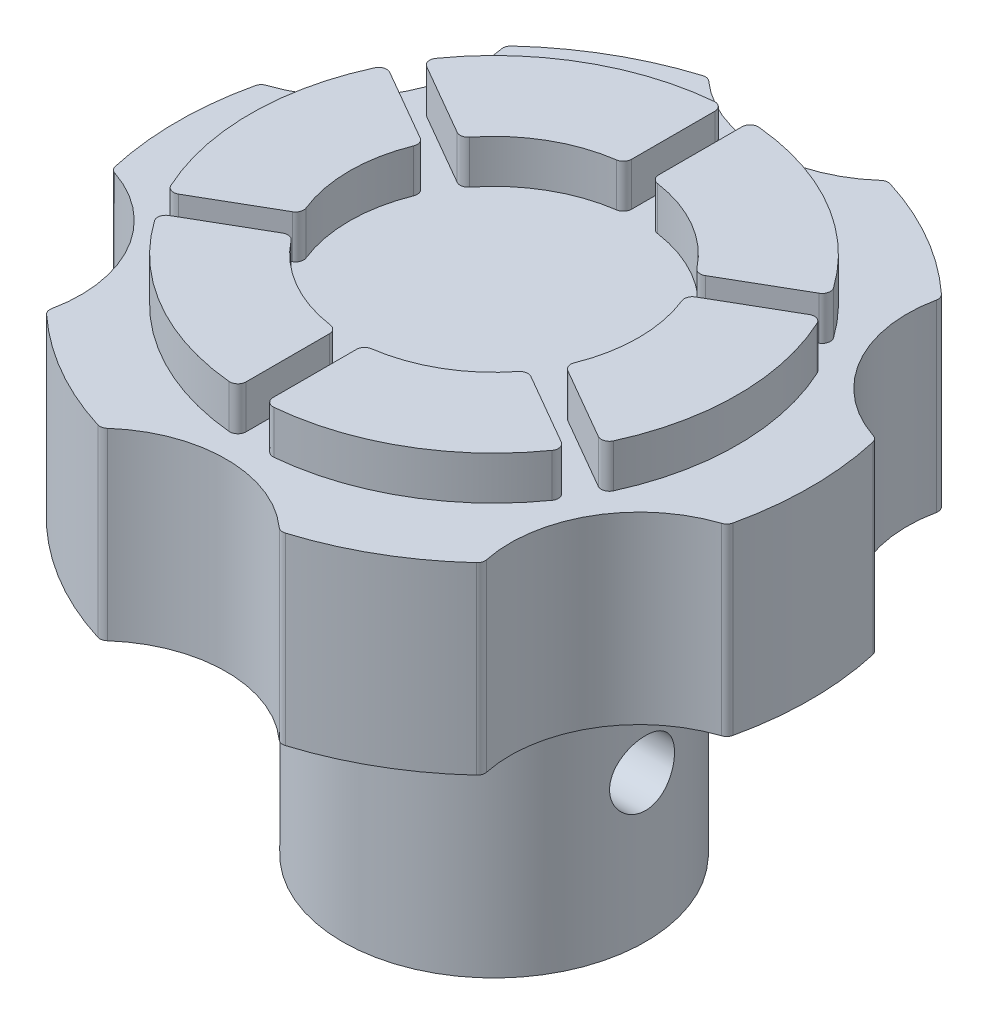
from build123d import *

# Parameters (mm, degrees)
SALIENTE_EXTRUIR1_DEPTH    = 17
CROQUIS2_R                 = 22.5
CROQUIS2_R_2               = 13.35
SALIENTE_EXTRUIR2_DEPTH    = 4
CORTAR_EXTRUIR1_DEPTH      = 4
CROQUIS4_R                 = 14
SALIENTE_EXTRUIR3_DEPTH    = 2
CROQUIS5_R                 = 14
CROQUIS5_R_2               = 7.9375
SALIENTE_EXTRUIR4_DEPTH    = 25
CORTAR_EXTRUIR2_DEPTH      = 49.703824285
CORTAR_EXTRUIR2_DEPTH_BACK = 49.703824285
CROQUIS6_R                 = 3
REDONDEO1_R                = 1
CHAFL_N1_SIZE              = 1
REDONDEO2_R                = 0.75


with BuildPart() as part:
    # Croquis1 → Saliente-Extruir1 (new body)
    with BuildSketch(Plane(origin=(0, 0, 0), x_dir=(1, 0, 0), z_dir=(0, 1, 0))):
        with BuildLine():
            ThreePointArc((8.25, -28.062430401), (14.625, -25.331243061), (20.177777619, -21.175924782))
            ThreePointArc((20.177777619, -21.175924782), (21.434128744, -12.375), (28.427777619, -6.886505619))
            ThreePointArc((28.427777619, -6.886505619), (29.25, 0), (28.427777619, 6.886505619))
            ThreePointArc((28.427777619, 6.886505619), (21.434128744, 12.375), (20.177777619, 21.175924782))
            ThreePointArc((20.177777619, 21.175924782), (14.625, 25.331243061), (8.25, 28.062430401))
            ThreePointArc((8.25, 28.062430401), (0, 24.75), (-8.25, 28.062430401))
            ThreePointArc((-8.25, 28.062430401), (-14.625, 25.331243061), (-20.177777619, 21.175924782))
            ThreePointArc((-20.177777619, 21.175924782), (-21.434128744, 12.375), (-28.427777619, 6.886505619))
            ThreePointArc((-28.427777619, 6.886505619), (-29.25, 0), (-28.427777619, -6.886505619))
            ThreePointArc((-28.427777619, -6.886505619), (-21.434128744, -12.375), (-20.177777619, -21.175924782))
            ThreePointArc((-20.177777619, -21.175924782), (-14.625, -25.331243061), (-8.25, -28.062430401))
            ThreePointArc((-8.25, -28.062430401), (0, -24.75), (8.25, -28.062430401))
        make_face()
    extrude(amount=SALIENTE_EXTRUIR1_DEPTH)

    # Croquis2 → Saliente-Extruir2 (add)
    with BuildSketch(Plane(origin=(0, 17, 0), x_dir=(1, 0, 0), z_dir=(0, 1, 0))):
        with Locations(Location((0, 0, 0), (0, 0, 270))):
            Circle(CROQUIS2_R)
        with Locations(Location((0, 0, 0), (0, 0, 270))):
            Circle(CROQUIS2_R_2, mode=Mode.SUBTRACT)
    extrude(amount=SALIENTE_EXTRUIR2_DEPTH)

    # Croquis3 → Cortar-Extruir1 (cut)
    with BuildSketch(Plane(origin=(0, 17, 0), x_dir=(1, 0, 0), z_dir=(0, 1, 0))):
        with BuildLine():
            Line((-1.25, -22.465250945), (-1.25, -2.165063509))
            Line((-1.25, -2.165063509), (-18.83047802, -12.315157227))
            ThreePointArc((-18.83047802, -12.315157227), (-19.485571585, -11.25), (-20.08047802, -10.150093718))
            Line((-20.08047802, -10.150093718), (-2.5, 0))
            Line((-2.5, 0), (-20.08047802, 10.150093718))
            ThreePointArc((-20.08047802, 10.150093718), (-19.485571585, 11.25), (-18.83047802, 12.315157227))
            Line((-18.83047802, 12.315157227), (-1.25, 2.165063509))
            Line((-1.25, 2.165063509), (-1.25, 22.465250945))
            ThreePointArc((-1.25, 22.465250945), (0, 22.5), (1.25, 22.465250945))
            Line((1.25, 22.465250945), (1.25, 2.165063509))
            Line((1.25, 2.165063509), (18.83047802, 12.315157227))
            ThreePointArc((18.83047802, 12.315157227), (19.485571585, 11.25), (20.08047802, 10.150093718))
            Line((20.08047802, 10.150093718), (2.5, 0))
            Line((2.5, 0), (20.08047802, -10.150093718))
            ThreePointArc((20.08047802, -10.150093718), (19.485571585, -11.25), (18.83047802, -12.315157227))
            Line((18.83047802, -12.315157227), (1.25, -2.165063509))
            Line((1.25, -2.165063509), (1.25, -22.465250945))
            ThreePointArc((1.25, -22.465250945), (0, -22.5), (-1.25, -22.465250945))
        make_face()
    extrude(amount=CORTAR_EXTRUIR1_DEPTH, mode=Mode.SUBTRACT)

    # Croquis4 → Saliente-Extruir3 (add)
    with BuildSketch(Plane.XZ):
        with Locations(Location((0, 0, 0), (0, 0, 270))):
            Circle(CROQUIS4_R)
    extrude(amount=SALIENTE_EXTRUIR3_DEPTH)

    # Croquis5 → Saliente-Extruir4 (add)
    with BuildSketch(Plane.XZ.offset(2)):
        with Locations(Location((0, 0, 0), (0, 0, 270))):
            Circle(CROQUIS5_R)
        with Locations(Location((0, 0, 0), (0, 0, 270))):
            Circle(CROQUIS5_R_2, mode=Mode.SUBTRACT)
    extrude(amount=SALIENTE_EXTRUIR4_DEPTH)

    # Croquis6 → Cortar-Extruir2 (cut, two sides: drawn at the far end of the back side and taken through both)
    with BuildSketch(Plane(origin=(0, 0, 0), x_dir=(0, 0, -1), z_dir=(1, 0, 0)).offset(-CORTAR_EXTRUIR2_DEPTH_BACK)):
        with Locations((0, -13.5)):
            Circle(CROQUIS6_R)
    extrude(amount=CORTAR_EXTRUIR2_DEPTH + CORTAR_EXTRUIR2_DEPTH_BACK, mode=Mode.SUBTRACT)

    # Redondeo1
    redondeo1_edges = [part.edges().sort_by_distance(p)[0] for p in [
        (0, 0, 14),
    ]]
    fillet(redondeo1_edges, radius=REDONDEO1_R)

    # Chaflán1
    chafl_n1_edges = [part.edges().sort_by_distance(p)[0] for p in [
        (0, -27, 7.9375),
    ]]
    chamfer(chafl_n1_edges, length=CHAFL_N1_SIZE)

    # Redondeo2
    redondeo2_edges = [part.edges().sort_by_distance(p)[0] for p in [
        (-1.25, 19, -22.465250945),
        (-10.885647245, 19, -7.72820704),
        (-18.83047802, 19, -12.315157227),
        (-12.135647245, 19, -5.563143531),
        (-20.08047802, 19, -10.150093718),
        (-12.135647245, 19, 5.563143531),
        (-20.08047802, 19, 10.150093718),
        (-8.25, 8.5, -28.062430401),
        (8.25, 8.5, -28.062430401),
        (20.177777619, 8.5, -21.175924782),
        (28.427777619, 8.5, -6.886505619),
        (28.427777619, 8.5, 6.886505619),
        (20.177777619, 8.5, 21.175924782),
        (8.25, 8.5, 28.062430401),
        (-8.25, 8.5, 28.062430401),
        (-20.177777619, 8.5, 21.175924782),
        (-28.427777619, 8.5, 6.886505619),
        (-28.427777619, 8.5, -6.886505619),
        (-20.177777619, 8.5, -21.175924782),
        (-10.885647245, 19, 7.72820704),
        (-18.83047802, 19, 12.315157227),
        (-1.25, 19, 13.291350571),
        (-1.25, 19, 22.465250945),
        (1.25, 19, 13.291350571),
        (1.25, 19, 22.465250945),
        (10.885647245, 19, 7.72820704),
        (18.83047802, 19, 12.315157227),
        (12.135647245, 19, 5.563143531),
        (20.08047802, 19, 10.150093718),
        (12.135647245, 19, -5.563143531),
        (20.08047802, 19, -10.150093718),
        (10.885647245, 19, -7.72820704),
        (18.83047802, 19, -12.315157227),
        (1.25, 19, -13.291350571),
        (1.25, 19, -22.465250945),
        (-1.25, 19, -13.291350571),
    ]]
    fillet(redondeo2_edges, radius=REDONDEO2_R)


solid = part.part
